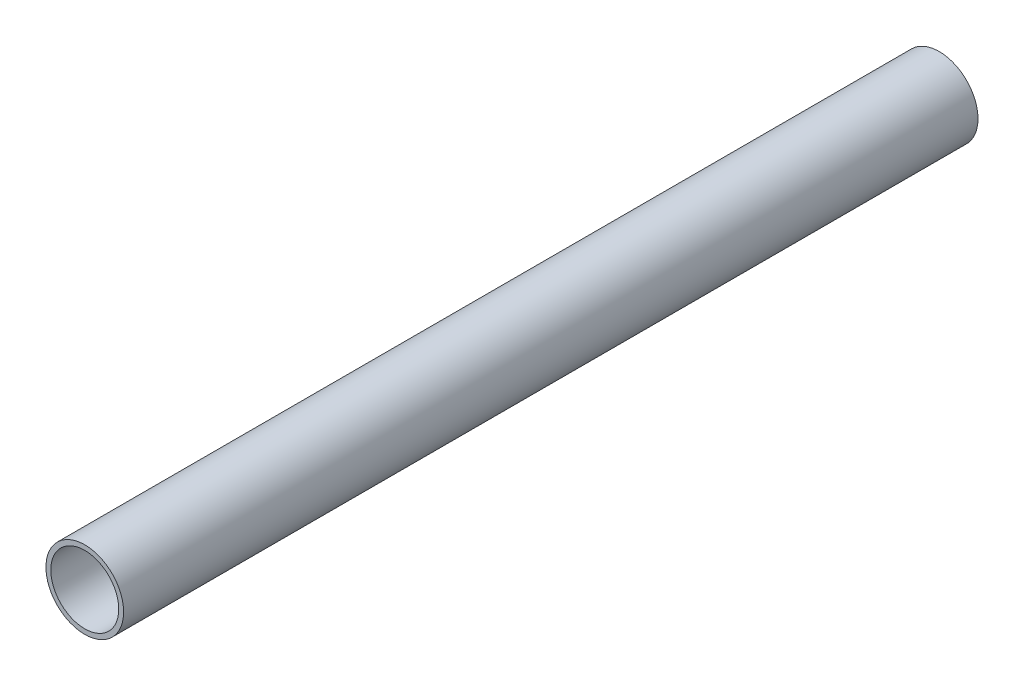
from build123d import *

# Parameters (mm, degrees)
SKETCH1_R           = 12.7
SKETCH1_R_2         = 11.1125
BOSS_EXTRUDE1_DEPTH = 279.4


with BuildPart() as part:
    # Sketch1 → Boss-Extrude1 (new body)
    with BuildSketch(Plane.XY):
        Circle(SKETCH1_R)
        Circle(SKETCH1_R_2, mode=Mode.SUBTRACT)
    extrude(amount=BOSS_EXTRUDE1_DEPTH)


solid = part.part
